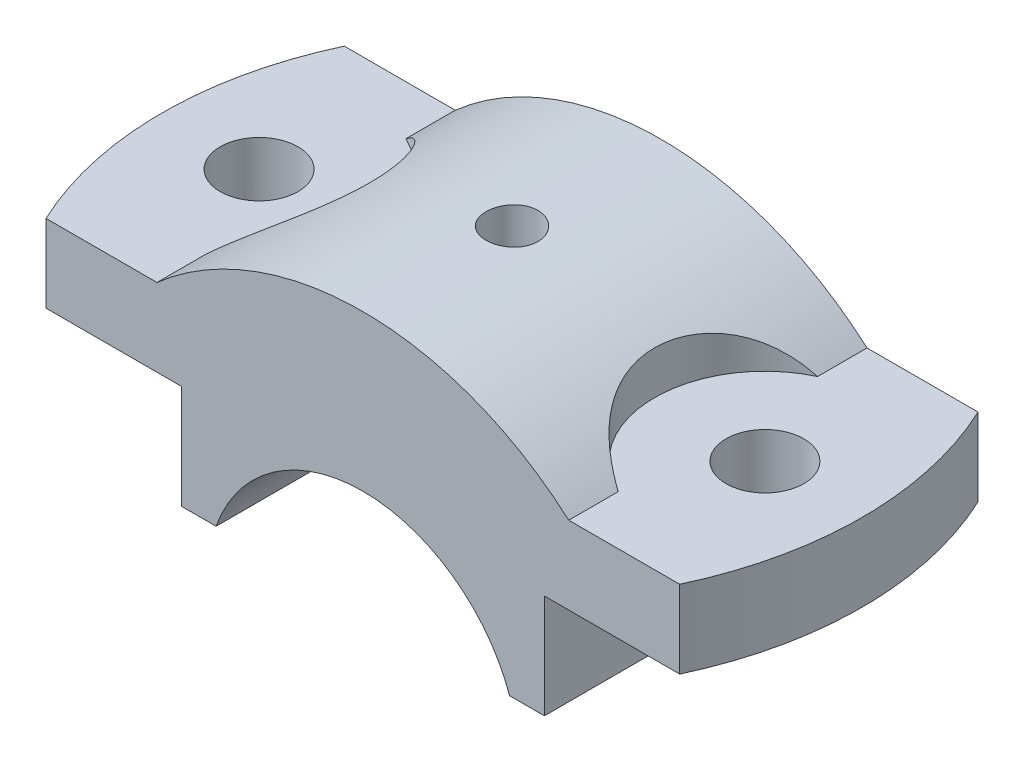
from build123d import *

# Parameters (mm, degrees)
BOSS_EXTRUDE1_DEPTH = 46
CUT_EXTRUDE1_DEPTH  = 77.26270386
SKETCH3_R           = 6
CUT_EXTRUDE2_DEPTH  = 77.26270386
SKETCH5_R           = 3
CUT_EXTRUDE3_DEPTH  = 82.437092286
SKETCH6_R           = 4
CUT_EXTRUDE4_DEPTH  = 16
CUT_EXTRUDE5_DEPTH  = 77.262703957


with BuildPart() as part:
    # Sketch1 → Boss-Extrude1 (new body)
    with BuildSketch(Plane.XY):
        with BuildLine():
            Line((22.627416998, 0), (28, 0))
            Line((28, 0), (28, 16))
            Line((28, 16), (54, 16))
            Line((54, 16), (54, 28))
            Line((54, 28), (31.749015733, 28))
            ThreePointArc((31.749015733, 28), (0, 40), (-31.749015733, 28))
            Line((-31.749015733, 28), (-54, 28))
            Line((-54, 28), (-54, 16.005791269))
            Line((-54, 16.005791269), (-28, 16.005791269))
            Line((-28, 16.005791269), (-28, 0))
            Line((-28, 0), (-22.627416998, 0))
            ThreePointArc((-22.627416998, 0), (0, 16), (22.627416998, 0))
        make_face()
    extrude(amount=BOSS_EXTRUDE1_DEPTH)

    # Sketch2 → Cut-Extrude1 (cut, through all)
    with BuildSketch(Plane(origin=(0, 28, 0), x_dir=(1, 0, 0), z_dir=(0, 1, 0))):
        with BuildLine():
            Line((54, -46), (54, -23))
            ThreePointArc((54, -23), (52.698550436, -34.784005345), (48.856934001, -46))
            Line((48.856934001, -46), (54, -46))
        make_face()
        with BuildLine():
            Line((54, 0), (48.856934001, 0))
            ThreePointArc((48.856934001, 0), (52.698550436, -11.215994655), (54, -23))
            Line((54, -23), (54, 0))
        make_face()
        with BuildLine():
            ThreePointArc((-54, -23.000000162), (-52.698550453, -11.215994734), (-48.856934001, 0))
            Line((-48.856934001, 0), (-54, 0))
            Line((-54, 0), (-54, -23.000000162))
        make_face()
        with BuildLine():
            ThreePointArc((-48.856934001, -46), (-52.698550418, -34.784005424), (-54, -23.000000162))
            Line((-54, -23.000000162), (-54, -46))
            Line((-54, -46), (-48.856934001, -46))
        make_face()
    extrude(amount=-CUT_EXTRUDE1_DEPTH, mode=Mode.SUBTRACT)

    # Sketch3 → Cut-Extrude2 (cut, through all)
    with BuildSketch(Plane(origin=(0, 28, 0), x_dir=(1, 0, 0), z_dir=(0, 1, 0))):
        with Locations(Location((39, -23, 0), (0, 0, 180))):
            Circle(SKETCH3_R)
        with Locations(Location((-39, -23, 0), (0, 0, 270))):
            Circle(SKETCH3_R)
    extrude(amount=-CUT_EXTRUDE2_DEPTH, mode=Mode.SUBTRACT)

    # Sketch5 → Cut-Extrude3 (cut, through all)
    with BuildSketch(Plane(origin=(0, 40, 0), x_dir=(1, 0, 0), z_dir=(0, 1, 0))):
        with Locations(Location((0, -23, 0), (0, 0, 270))):
            Circle(SKETCH5_R)
    extrude(amount=-CUT_EXTRUDE3_DEPTH, mode=Mode.SUBTRACT)

    # Sketch6 → Cut-Extrude4 (cut)
    with BuildSketch(Plane(origin=(0, 40, 0), x_dir=(1, 0, 0), z_dir=(0, 1, 0))):
        with Locations(Location((0, -23, 0), (0, 0, 270))):
            Circle(SKETCH6_R)
    extrude(amount=-CUT_EXTRUDE4_DEPTH, mode=Mode.SUBTRACT)

    # Sketch7 → Cut-Extrude5 (cut, through all)
    with BuildSketch(Plane(origin=(0, 28, 0), x_dir=(1, 0, 0), z_dir=(0, 1, 0))):
        with BuildLine():
            ThreePointArc((-31.749015733, -7.623939804), (-22, -23), (-31.749015733, -38.376060196))
            Line((-31.749015733, -38.376060196), (-31.749015733, -7.623939804))
        make_face()
        with BuildLine():
            Line((31.749015733, -38.376060196), (31.749015733, -7.623939804))
            ThreePointArc((31.749015733, -7.623939804), (22, -23), (31.749015733, -38.376060196))
        make_face()
    extrude(amount=CUT_EXTRUDE5_DEPTH, mode=Mode.SUBTRACT)


solid = part.part
